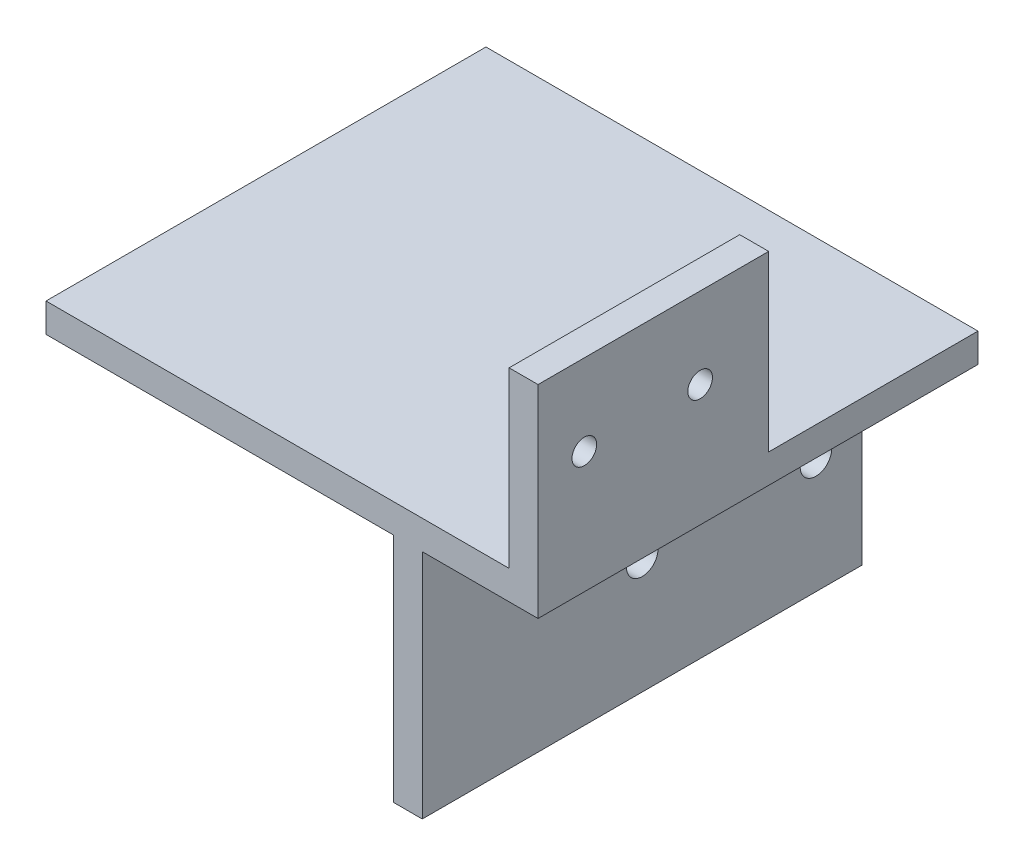
from build123d import *

# Parameters (mm, degrees)
BOSS_EXTRUDE1_DEPTH       = 48.26
SKETCH2_W                 = 3.175
SKETCH2_H                 = 25.298904356
BOSS_EXTRUDE2_DEPTH       = 19.05
TAP_DRILL_FOR_6_32_TAP1_D = 2.7051
TAP_DRILL_FOR_8_32_TAP1_D = 3.4544


with BuildPart() as part:
    # Sketch1 → Boss-Extrude1 (new body)
    with BuildSketch(Plane.XY):
        Polygon((15.875, 28.575), (-38.1, 28.575), (-38.1, 25.4), (0, 25.4), (0, 0), (3.175, 0), (3.175, 25.4), (15.875, 25.4), align=None)
    extrude(amount=BOSS_EXTRUDE1_DEPTH)

    # Sketch2 → Boss-Extrude2 (add)
    with BuildSketch(Plane(origin=(0, 28.575, 0), x_dir=(1, 0, 0), z_dir=(0, 1, 0))):
        with Locations((14.2875, -35.610547822)):
            Rectangle(SKETCH2_W, SKETCH2_H)
    extrude(amount=BOSS_EXTRUDE2_DEPTH)

    # Tap Drill for #6-32 Tap1 (through all)
    with Locations(Plane(origin=(15.875, 0, 0), x_dir=(0, 0, -1), z_dir=(1, 0, 0))):
        with Locations((-43.18, 38.735), (-30.48, 38.735)):
            Hole(TAP_DRILL_FOR_6_32_TAP1_D / 2)

    # Tap Drill for #8-32 Tap1 (through all)
    with Locations(Plane.ZY):
        with Locations((5.08, 12.7), (24.13, 12.7)):
            Hole(TAP_DRILL_FOR_8_32_TAP1_D / 2)


solid = part.part
